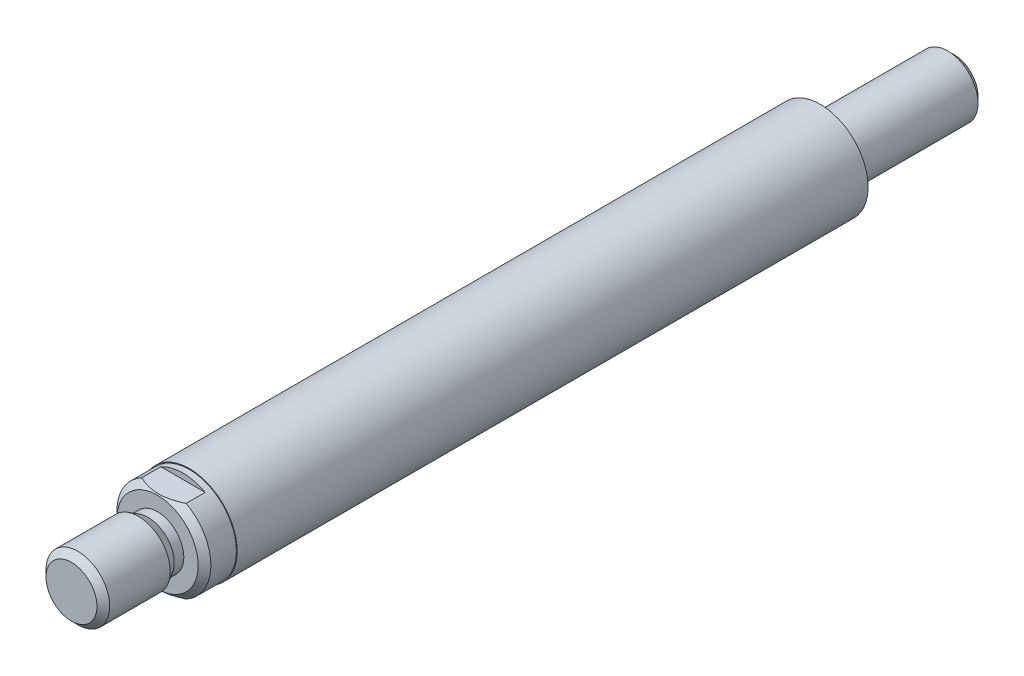
from build123d import *

# Parameters (mm, degrees)
ESQUISSE1_R                   = 15
TIGE_DEPTH                    = 277
ESQUISSE2_OUTSIDE_W           = 88.046
ESQUISSE2_OUTSIDE_H           = 88.046
ESQUISSE2_OUTSIDE_R           = 14.75
CENTRAGE_DE_CHAPE_DEPTH       = 37
ESQUISSE3_OUTSIDE_W           = 88.046
ESQUISSE3_OUTSIDE_H           = 88.046
ESQUISSE3_OUTSIDE_R           = 10
DIAM_TRE_DE_FILETAGE_DEPTH    = 27
ESQUISSE4_OUTSIDE_W           = 88.046
ESQUISSE4_OUTSIDE_H           = 88.046
ESQUISSE4_OUTSIDE_R           = 8.25
GORGE_DE_D_GAGEMENT_DEPTH     = 3
ESQUISSE5_OUTSIDE_W           = 91.51
ESQUISSE5_OUTSIDE_H           = 91.51
ESQUISSE5_OUTSIDE_R           = 8.25
CHANFREIN_DE_D_GAGEMENT_DEPTH = 3
CHANFREIN_DE_D_GAGEMENT_DRAFT = -30
CHANFREIN4_SIZE               = 2
M_PLAT_1_REACH                = 280.815
ESQUISSE6_W                   = 29.5
ESQUISSE6_H                   = 8
ESQUISSE7_OUTSIDE_W           = 88.046
ESQUISSE7_OUTSIDE_H           = 88.046
ESQUISSE7_OUTSIDE_R           = 9.5
CENTRAGE_DE_PISTON_DEPTH      = 42
CHANFREIN_DE_FILETAGE_SIZE    = 2


with BuildPart() as part:
    # Esquisse1 → tige (new body)
    with BuildSketch(Plane.XY):
        with Locations(Location((0, 0, 0), (0, 0, 180))):
            Circle(ESQUISSE1_R)
    extrude(amount=TIGE_DEPTH)

    # Esquisse2 outside → centrage de chape (cut)
    with BuildSketch(Plane.XY.offset(277)):
        Rectangle(ESQUISSE2_OUTSIDE_W, ESQUISSE2_OUTSIDE_H)
        Circle(ESQUISSE2_OUTSIDE_R, mode=Mode.SUBTRACT)
    extrude(amount=-CENTRAGE_DE_CHAPE_DEPTH, mode=Mode.SUBTRACT)

    # Esquisse3 outside → diamètre de filetage (cut)
    with BuildSketch(Plane.XY.offset(277)):
        Rectangle(ESQUISSE3_OUTSIDE_W, ESQUISSE3_OUTSIDE_H)
        Circle(ESQUISSE3_OUTSIDE_R, mode=Mode.SUBTRACT)
    extrude(amount=-DIAM_TRE_DE_FILETAGE_DEPTH, mode=Mode.SUBTRACT)

    # Esquisse4 outside → gorge de d_gagement (cut)
    with BuildSketch(Plane.XY.offset(250)):
        Rectangle(ESQUISSE4_OUTSIDE_W, ESQUISSE4_OUTSIDE_H)
        with Locations(Location((0, 0, 0), (0, 0, 180))):
            Circle(ESQUISSE4_OUTSIDE_R, mode=Mode.SUBTRACT)
    extrude(amount=GORGE_DE_D_GAGEMENT_DEPTH, mode=Mode.SUBTRACT)


with BuildPart() as chanfrein_de_d_gagement_tool:
    # Esquisse5 outside → chanfrein de dégagement (with draft: the straight prism first)
    with BuildSketch(Plane(origin=(0, 0, 253), x_dir=(-1, 0, 0), z_dir=(0, 0, -1))):
        Rectangle(ESQUISSE5_OUTSIDE_W, ESQUISSE5_OUTSIDE_H)
        Circle(ESQUISSE5_OUTSIDE_R, mode=Mode.SUBTRACT)
    extrude(amount=-CHANFREIN_DE_D_GAGEMENT_DEPTH)
    # chanfrein de dégagement: the draft: its side faces are tilted about the plane it starts from
    chanfrein_de_d_gagement_sides = [chanfrein_de_d_gagement_tool.faces().sort_by_distance(p)[0] for p in [
        (0, -45.755, 254.5),
        (-45.755, 0, 254.5),
        (0, 45.755, 254.5),
        (45.755, 0, 254.5),
        (8.25, 0, 254.5),
    ]]
    draft(chanfrein_de_d_gagement_sides, Plane(origin=(0, 0, 253), x_dir=(-1, 0, 0), z_dir=(0, 0, -1)), CHANFREIN_DE_D_GAGEMENT_DRAFT)


with BuildPart() as part_1:
    add(part.part)

    # chanfrein de dégagement: cut by chanfrein_de_d_gagement_tool
    add(chanfrein_de_d_gagement_tool.part, mode=Mode.SUBTRACT)

    # Chanfrein4
    chanfrein4_edges = [part_1.edges().sort_by_distance(p)[0] for p in [
        (-14.75, 0, 250),
        (-10, 0, 277),
    ]]
    chamfer(chanfrein4_edges, length=CHANFREIN4_SIZE)

    # Esquisse6 → méplat 1 (cut, up to next)
    with BuildSketch(Plane(origin=(0, 13, 0), x_dir=(-1, 0, 0), z_dir=(0, 1, 0)), mode=Mode.PRIVATE) as m_plat_1_sk1:
        with Locations((0, 246)):
            Rectangle(ESQUISSE6_W, ESQUISSE6_H)
    m_plat_1_tool1 = extrude(m_plat_1_sk1.sketch, amount=M_PLAT_1_REACH, mode=Mode.PRIVATE) & part_1.part
    m_plat_1 = m_plat_1_tool1.solids().sort_by_distance((0, 13, 246))[0]
    add(m_plat_1, mode=Mode.SUBTRACT)

    # méplat 2: méplat 1 across plane
    add(m_plat_1.mirror(Plane.ZX), mode=Mode.SUBTRACT)

    # Esquisse7 outside → centrage de piston (cut)
    with BuildSketch(Plane(origin=(0, 0, 0), x_dir=(-1, 0, 0), z_dir=(0, 0, -1))):
        Rectangle(ESQUISSE7_OUTSIDE_W, ESQUISSE7_OUTSIDE_H)
        Circle(ESQUISSE7_OUTSIDE_R, mode=Mode.SUBTRACT)
    extrude(amount=-CENTRAGE_DE_PISTON_DEPTH, mode=Mode.SUBTRACT)

    # Chanfrein de filetage
    chanfrein_de_filetage_edges = [part_1.edges().sort_by_distance(p)[0] for p in [
        (9.5, 0, 0),
    ]]
    chamfer(chanfrein_de_filetage_edges, length=CHANFREIN_DE_FILETAGE_SIZE)


solid = part_1.part
